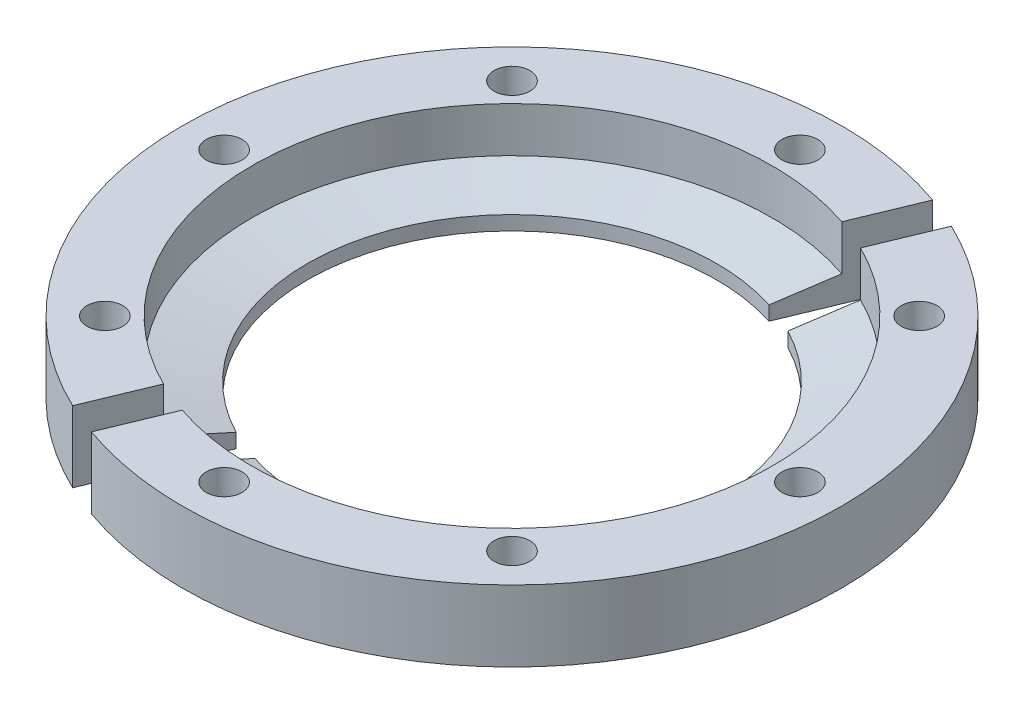
from build123d import *

# Parameters (mm, degrees)
SKETCH1_R           = 47.5
BOSS_EXTRUDE1_DEPTH = 10.25
SKETCH3_R           = 2.585
CUT_EXTRUDE1_DEPTH  = 68.952648955
CIRPATTERN1_COUNT   = 8
CUT_EXTRUDE2_DEPTH  = 68.952648955


with BuildPart() as part:
    # Sketch1 → Boss-Extrude1 (new body)
    with BuildSketch(Plane(origin=(0, 0, 0), x_dir=(1, 0, 0), z_dir=(0, 1, 0))):
        with Locations(Location((0, 0, 0), (0, 0, 270))):
            Circle(SKETCH1_R)
    extrude(amount=BOSS_EXTRUDE1_DEPTH)

    # Sketch2 → Cut-Revolve1 (revolve, cut)
    with BuildSketch(Plane.XY, mode=Mode.PRIVATE) as cut_revolve1_sk:
        Polygon((29.5, 0), (29.5, 2.049547507), (37.5, 3.75), (37.5, 10.25), (0, 10.25), (0, 0), align=None)
    revolve(cut_revolve1_sk.sketch.rotate(Axis((0, 0, 0), (0, -1, 0)), 90), axis=Axis((0, 0, 0), (0, -1, 0)), mode=Mode.SUBTRACT)

    # Sketch3 → Cut-Extrude1 (cut, through all)
    with BuildSketch(Plane(origin=(0, 10.25, 0), x_dir=(1, 0, 0), z_dir=(0, 1, 0))):
        with Locations(Location((41.5, 0, 0), (0, 0, 270))):
            Circle(SKETCH3_R)
    cut_extrude1 = extrude(amount=-CUT_EXTRUDE1_DEPTH, mode=Mode.SUBTRACT)

    # CirPattern1: Cut-Extrude1 ×8 about axis
    cirpattern1_axis = Axis((0, 0, 0), (0, 1, 0))
    for i in range(1, CIRPATTERN1_COUNT):
        add(cut_extrude1.rotate(cirpattern1_axis, i * 360 / CIRPATTERN1_COUNT), mode=Mode.SUBTRACT)

    # Sketch4 → Cut-Extrude2 (cut, through all)
    with BuildSketch(Plane(origin=(0, 10.25, 0), x_dir=(1, 0, 0), z_dir=(0, 1, 0))):
        with BuildLine():
            Line((15.842570205, 44.780162676), (-20.461967868, -42.866745514))
            ThreePointArc((-20.461967868, -42.866745514), (-18.177463037, -43.884277794), (-15.842570205, -44.780162676))
            Line((-15.842570205, -44.780162676), (20.461967868, 42.866745514))
            ThreePointArc((20.461967868, 42.866745514), (18.177463037, 43.884277794), (15.842570205, 44.780162676))
        make_face()
    extrude(amount=-CUT_EXTRUDE2_DEPTH, mode=Mode.SUBTRACT)


with BuildPart() as cut_extrude2_piece_1:
    # of the separate pieces the step leaves, piece 1, a body of its own (cut_extrude2_pieces)
    add(part.part.solids().sort_by_distance((-15.842570205, 0, 44.780162676))[0])


with BuildPart() as cut_extrude2_piece_2:
    # of the separate pieces the step leaves, piece 2, a body of its own (cut_extrude2_pieces)
    add(part.part.solids().sort_by_distance((15.842570205, 0, -44.780162676))[0])


solid = Compound([cut_extrude2_piece_1.part, cut_extrude2_piece_2.part])
